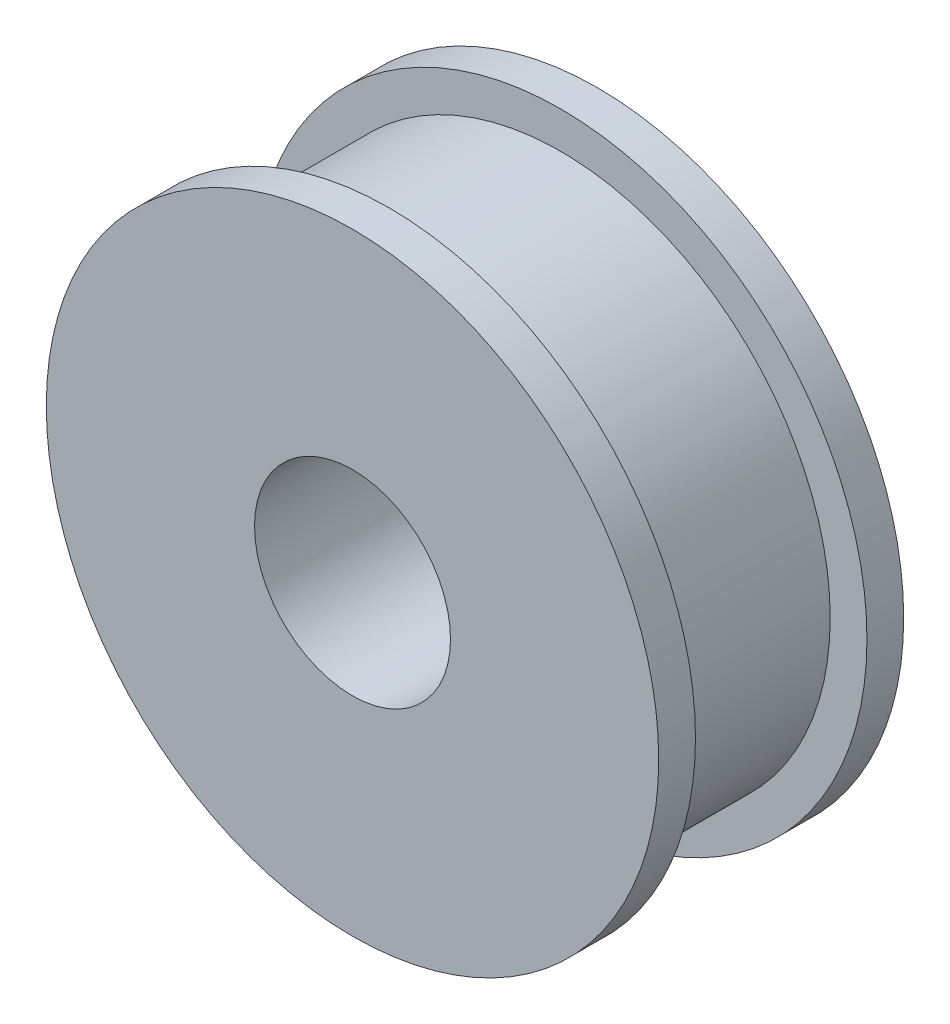
from build123d import *

# Parameters (mm, degrees)
SKETCH2_R               = 12.5
SKETCH2_R_2             = 4
BOSS_EXTRUDE1_DEPTH     = 10
CUT_EXTRUDE_THIN1_START = 1.5
SKETCH2_3_R             = 21
SKETCH2_3_R_2           = 11
CUT_EXTRUDE_THIN1_DEPTH = 7


with BuildPart() as part:
    # Sketch2 → Boss-Extrude1 (new body)
    with BuildSketch(Plane.XY):
        Circle(SKETCH2_R)
        Circle(SKETCH2_R_2, mode=Mode.SUBTRACT)
    extrude(amount=BOSS_EXTRUDE1_DEPTH)

    # Sketch2<3> → Cut-Extrude-Thin1 (cut)
    with BuildSketch(Plane.XY.offset(CUT_EXTRUDE_THIN1_START)):
        Circle(SKETCH2_3_R)
        Circle(SKETCH2_3_R_2, mode=Mode.SUBTRACT)
    extrude(amount=CUT_EXTRUDE_THIN1_DEPTH, mode=Mode.SUBTRACT)


solid = part.part
